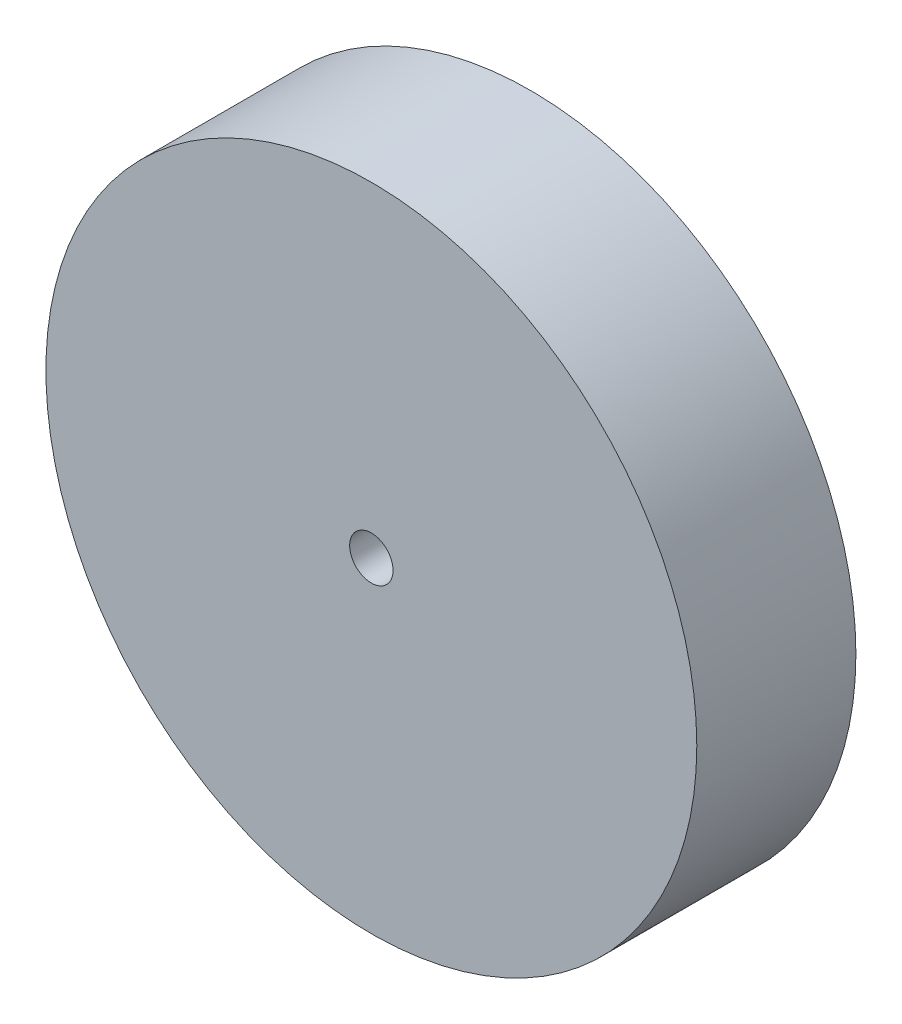
from build123d import *

# Parameters (mm, degrees)
SKETCH1_R           = 22.5
BOSS_EXTRUDE1_DEPTH = 11
SKETCH2_R           = 1.5
CUT_EXTRUDE1_DEPTH  = 34.667491739


with BuildPart() as part:
    # Sketch1 → Boss-Extrude1 (new body)
    with BuildSketch(Plane.XY):
        Circle(SKETCH1_R)
    extrude(amount=BOSS_EXTRUDE1_DEPTH)

    # Sketch2 → Cut-Extrude1 (cut, through all)
    with BuildSketch(Plane.XY.offset(11)):
        Circle(SKETCH2_R)
    extrude(amount=-CUT_EXTRUDE1_DEPTH, mode=Mode.SUBTRACT)


solid = part.part
